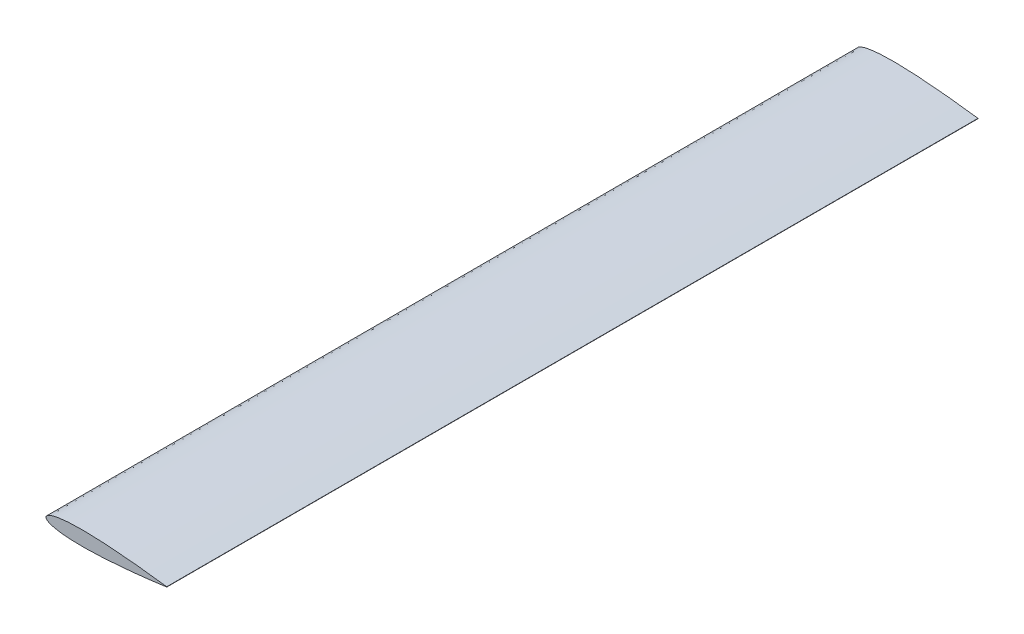
from build123d import *

# Parameters (mm, degrees)
BOSS_EXTRUDE1_DEPTH = 168


with BuildPart() as part:
    # Sketch1 → Boss-Extrude1 (new body)
    with BuildSketch(Plane.XY):
        with BuildLine():
            Line((25, 0.0315), (25, -0.0315))
            add(Edge.make_bspline(
                [(25, 0.0315), (24.99513402, 0.032182808), (24.975682974, 0.034912235), (24.9319603, 0.041031964), (24.762878747, 0.064653747), (24.394396644, 0.115513522), (23.960826063, 0.173893734), (23.559615169, 0.22674682), (23.266269629, 0.264888121), (22.264440193, 0.393245255), (21.20272832, 0.520803388), (19.915350999, 0.665636111), (19.075270819, 0.756861469), (18.022971426, 0.865404641), (16.91910813, 0.972755424), (15.971445961, 1.058784724), (14.996174562, 1.142052565), (14.002413803, 1.221123343), (13.002470341, 1.291903569), (11.997994706, 1.355346881), (11.1958145, 1.399437267), (10.397261772, 1.435692558), (9.804873419, 1.458516197), (9.218777058, 1.476750564), (8.64034122, 1.490133131), (8.070915921, 1.498408121), (7.511830082, 1.501350023), (6.964389325, 1.49876702), (6.429871686, 1.490506616), (5.909525215, 1.476435702), (5.404563712, 1.45648442), (4.916166328, 1.430610116), (4.445473087, 1.398809788), (3.993581035, 1.361134548), (3.561542921, 1.317674025), (3.150366274, 1.26854725), (2.761005882, 1.213933229), (2.394368534, 1.154009047), (2.051299558, 1.08902815), (1.732592266, 1.019223668), (1.438972406, 0.944882346), (1.171105933, 0.866273939), (0.929582246, 0.783696736), (0.71491755, 0.697423484), (0.527536949, 0.607714278), (0.367772948, 0.514770908), (0.235859321, 0.418700069), (0.131989531, 0.319408133), (0.056496901, 0.216548838), (0.010301038, 0.10967394), (-0.005021465, 0), (0.010301038, -0.10967394), (0.056496901, -0.216548838), (0.131989531, -0.319408133), (0.235859321, -0.418700069), (0.367772948, -0.514770908), (0.527536949, -0.607714278), (0.71491755, -0.697423484), (0.929582246, -0.783696736), (1.171105933, -0.866273939), (1.438972406, -0.944882346), (1.732592266, -1.019223668), (2.051299558, -1.08902815), (2.394368534, -1.154009047), (2.761005882, -1.213933229), (3.150366274, -1.26854725), (3.561542921, -1.317674025), (3.993581035, -1.361134548), (4.445473087, -1.398809788), (4.916166328, -1.430610116), (5.404563712, -1.45648442), (5.909525215, -1.476435702), (6.429871686, -1.490506616), (6.964389325, -1.49876702), (7.511830082, -1.501350023), (8.070915921, -1.498408121), (8.64034122, -1.490133131), (9.218777058, -1.476750564), (9.804873419, -1.458516197), (10.397261772, -1.435692558), (11.1958145, -1.399437267), (11.997994706, -1.355346881), (13.002470341, -1.291903569), (14.002413879, -1.221123089), (15.189285078, -1.126687347), (16.164403099, -1.041588874), (17.111918585, -0.954004594), (18.191578664, -0.849007459), (19.551763838, -0.706838119), (20.823696294, -0.56390321), (21.941973639, -0.431410888), (22.695827891, -0.337974681), (23.266269629, -0.264888121), (23.711517408, -0.206996225), (24.165584798, -0.146539645), (24.599038042, -0.087299151), (24.815761384, -0.057265702), (24.9319603, -0.041031964), (24.975682974, -0.034912235), (24.99513402, -0.032182808), (25, -0.0315)],
                knots=[0, 0, 0, 0, 0.000289157, 0.001155863, 0.002598059, 0.010335846, 0.023045738, 0.028342884, 0.034150148, 0.040453739, 0.087780102, 0.097077352, 0.11669075, 0.137507312, 0.159331022, 0.181956668, 0.193504002, 0.21693215, 0.240621471, 0.252494878, 0.276160723, 0.28789827, 0.299535918, 0.311046971, 0.322405028, 0.333584243, 0.34455942, 0.355305879, 0.365799645, 0.376017645, 0.385937518, 0.395537814, 0.404798066, 0.41369881, 0.422221683, 0.430349465, 0.438066153, 0.445357161, 0.452209437, 0.458611488, 0.464554012, 0.47002994, 0.475035093, 0.479569169, 0.483636928, 0.487250234, 0.490431505, 0.493218859, 0.495674083, 0.497891237, 0.5, 0.502108763, 0.504325917, 0.506781141, 0.509568495, 0.512749766, 0.516363072, 0.520430831, 0.524964907, 0.52997006, 0.535445988, 0.541388512, 0.547790563, 0.554642839, 0.561933847, 0.569650535, 0.577778317, 0.58630119, 0.595201934, 0.604462186, 0.614062482, 0.623982355, 0.634200355, 0.644694121, 0.65544058, 0.666415757, 0.677594972, 0.688953029, 0.700464082, 0.71210173, 0.723839277, 0.747505122, 0.759378529, 0.78306785, 0.806495998, 0.829443251, 0.840668978, 0.862492688, 0.893278153, 0.921148048, 0.937813561, 0.959546261, 0.965849852, 0.971657116, 0.985968595, 0.992806397, 0.997401941, 0.998844137, 0.999710843, 1, 1, 1, 1], degree=3))
        make_face()
    extrude(amount=BOSS_EXTRUDE1_DEPTH)


solid = part.part
